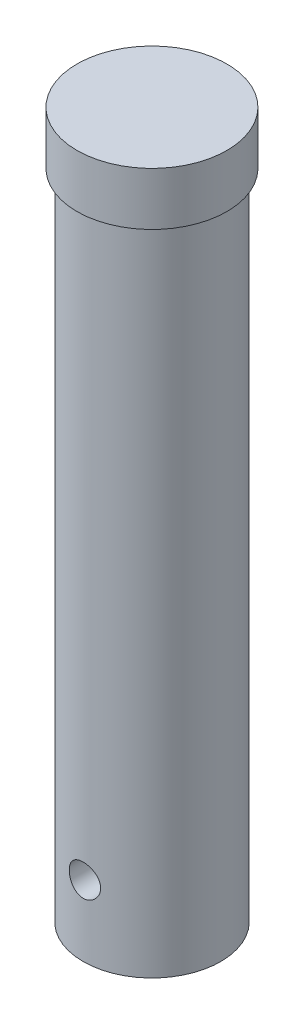
from build123d import *

# Parameters (mm, degrees)
SKETCH1_R             = 4.953
BOSS_EXTRUDE1_DEPTH   = 50.8
BOSS_EXTRUDE2_START   = -3.81
SKETCH2_R             = 5.3975
SKETCH2_R_2           = 4.953
BOSS_EXTRUDE2_DEPTH   = 3.81
F_4_40_TAPPED_HOLE1_D = 2.2606


with BuildPart() as part:
    # Sketch1 → Boss-Extrude1 (new body)
    with BuildSketch(Plane(origin=(0, 0, 0), x_dir=(1, 0, 0), z_dir=(0, 1, 0))):
        with Locations(Location((0, 0, 0), (0, 0, 270))):
            Circle(SKETCH1_R)
    extrude(amount=BOSS_EXTRUDE1_DEPTH)

    # Sketch2 → Boss-Extrude2 (add)
    with BuildSketch(Plane(origin=(0, 50.8, 0), x_dir=(1, 0, 0), z_dir=(0, 1, 0)).offset(BOSS_EXTRUDE2_START)):
        with Locations(Location((0, 0, 0), (0, 0, 270))):
            Circle(SKETCH2_R)
        with Locations(Location((0, 0, 0), (0, 0, 270))):
            Circle(SKETCH2_R_2, mode=Mode.SUBTRACT)
    extrude(amount=BOSS_EXTRUDE2_DEPTH)

    # #4-40 Tapped Hole1 (through all)
    with Locations(Plane.XY.offset(4.953)):
        with Locations((0, 5.08)):
            Hole(F_4_40_TAPPED_HOLE1_D / 2)


solid = part.part
